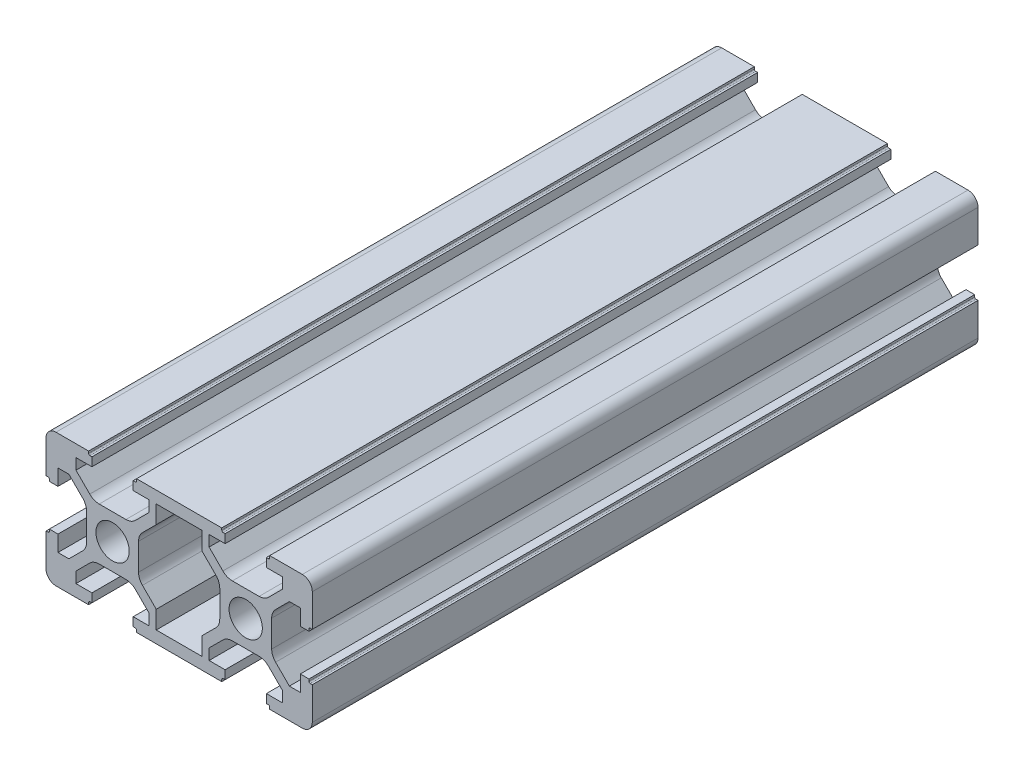
from build123d import *

# Parameters (mm, degrees)
SKETCH2_W               = 40
SKETCH2_H               = 20
BOSS_EXTRUDE1_DEPTH     = 100
CUT_EXTRUDE1_DEPTH      = 103.46950766
CUT_EXTRUDE1_DEPTH_BACK = 103.46950766
SKETCH3_R               = 2.5
FILLET1_R               = 1.5


with BuildPart() as part:
    # Sketch2 → Boss-Extrude1 (new body)
    with BuildSketch(Plane.XY):
        Rectangle(SKETCH2_W, SKETCH2_H)
    extrude(amount=-BOSS_EXTRUDE1_DEPTH)

    # Sketch3 → Cut-Extrude1 (cut, two sides: drawn at the far end of the back side and taken through both)
    with BuildSketch(Plane.XY.offset(-CUT_EXTRUDE1_DEPTH_BACK)):
        with Locations((-10, 0)):
            Circle(SKETCH3_R)
        with Locations(Location((10, 0, 0), (0, 0, 180))):
            Circle(SKETCH3_R)
        with BuildLine():
            Line((-13.6, 10), (-6.4, 10))
            Line((-6.4, 10), (-6.4, 9.7))
            ThreePointArc((-6.4, 9.7), (-6.458578644, 9.558578644), (-6.6, 9.5))
            Line((-6.6, 9.5), (-6.9, 9.5))
            Line((-6.9, 9.5), (-6.9, 8.2))
            Line((-6.9, 8.2), (-4.5, 8.2))
            Line((-4.5, 8.2), (-4.5, 6.560660172))
            Line((-4.5, 6.560660172), (-6.574873734, 4.485786438))
            ThreePointArc((-6.574873734, 4.485786438), (-7.223720432, 4.052240935), (-7.989087297, 3.9))
            Line((-7.989087297, 3.9), (-12.010912703, 3.9))
            ThreePointArc((-12.010912703, 3.9), (-12.776279568, 4.052240935), (-13.425126266, 4.485786438))
            Line((-13.425126266, 4.485786438), (-15.5, 6.560660172))
            Line((-15.5, 6.560660172), (-15.5, 8.2))
            Line((-15.5, 8.2), (-13.1, 8.2))
            Line((-13.1, 8.2), (-13.1, 9.5))
            Line((-13.1, 9.5), (-13.4, 9.5))
            ThreePointArc((-13.4, 9.5), (-13.541421356, 9.558578644), (-13.6, 9.7))
            Line((-13.6, 9.7), (-13.6, 10))
        make_face()
        with BuildLine():
            Line((-13.6, -10), (-13.6, -9.7))
            ThreePointArc((-13.6, -9.7), (-13.541421356, -9.558578644), (-13.4, -9.5))
            Line((-13.4, -9.5), (-13.1, -9.5))
            Line((-13.1, -9.5), (-13.1, -8.2))
            Line((-13.1, -8.2), (-15.5, -8.2))
            Line((-15.5, -8.2), (-15.5, -6.560660172))
            Line((-15.5, -6.560660172), (-13.425126266, -4.485786438))
            ThreePointArc((-13.425126266, -4.485786438), (-12.776279568, -4.052240935), (-12.010912703, -3.9))
            Line((-12.010912703, -3.9), (-7.989087297, -3.9))
            ThreePointArc((-7.989087297, -3.9), (-7.223720432, -4.052240935), (-6.574873734, -4.485786438))
            Line((-6.574873734, -4.485786438), (-4.5, -6.560660172))
            Line((-4.5, -6.560660172), (-4.5, -8.2))
            Line((-4.5, -8.2), (-6.9, -8.2))
            Line((-6.9, -8.2), (-6.9, -9.5))
            Line((-6.9, -9.5), (-6.6, -9.5))
            ThreePointArc((-6.6, -9.5), (-6.458578644, -9.558578644), (-6.4, -9.7))
            Line((-6.4, -9.7), (-6.4, -10))
            Line((-6.4, -10), (-13.6, -10))
        make_face()
        with BuildLine():
            Line((13.6, -10), (6.4, -10))
            Line((6.4, -10), (6.4, -9.7))
            ThreePointArc((6.4, -9.7), (6.458578644, -9.558578644), (6.6, -9.5))
            Line((6.6, -9.5), (6.9, -9.5))
            Line((6.9, -9.5), (6.9, -8.2))
            Line((6.9, -8.2), (4.5, -8.2))
            Line((4.5, -8.2), (4.5, -6.560660172))
            Line((4.5, -6.560660172), (6.574873734, -4.485786438))
            ThreePointArc((6.574873734, -4.485786438), (7.223720432, -4.052240935), (7.989087297, -3.9))
            Line((7.989087297, -3.9), (12.010912703, -3.9))
            ThreePointArc((12.010912703, -3.9), (12.776279568, -4.052240935), (13.425126266, -4.485786438))
            Line((13.425126266, -4.485786438), (15.5, -6.560660172))
            Line((15.5, -6.560660172), (15.5, -8.2))
            Line((15.5, -8.2), (13.1, -8.2))
            Line((13.1, -8.2), (13.1, -9.5))
            Line((13.1, -9.5), (13.4, -9.5))
            ThreePointArc((13.4, -9.5), (13.541421356, -9.558578644), (13.6, -9.7))
            Line((13.6, -9.7), (13.6, -10))
        make_face()
        with BuildLine():
            Line((13.6, 10), (13.6, 9.7))
            ThreePointArc((13.6, 9.7), (13.541421356, 9.558578644), (13.4, 9.5))
            Line((13.4, 9.5), (13.1, 9.5))
            Line((13.1, 9.5), (13.1, 8.2))
            Line((13.1, 8.2), (15.5, 8.2))
            Line((15.5, 8.2), (15.5, 6.560660172))
            Line((15.5, 6.560660172), (13.425126266, 4.485786438))
            ThreePointArc((13.425126266, 4.485786438), (12.776279568, 4.052240935), (12.010912703, 3.9))
            Line((12.010912703, 3.9), (7.989087297, 3.9))
            ThreePointArc((7.989087297, 3.9), (7.223720432, 4.052240935), (6.574873734, 4.485786438))
            Line((6.574873734, 4.485786438), (4.5, 6.560660172))
            Line((4.5, 6.560660172), (4.5, 8.2))
            Line((4.5, 8.2), (6.9, 8.2))
            Line((6.9, 8.2), (6.9, 9.5))
            Line((6.9, 9.5), (6.6, 9.5))
            ThreePointArc((6.6, 9.5), (6.458578644, 9.558578644), (6.4, 9.7))
            Line((6.4, 9.7), (6.4, 10))
            Line((6.4, 10), (13.6, 10))
        make_face()
        with BuildLine():
            Line((-16.560660172, -5.5), (-18.2, -5.5))
            Line((-18.2, -5.5), (-18.2, -3.1))
            Line((-18.2, -3.1), (-19.5, -3.1))
            Line((-19.5, -3.1), (-19.5, -3.4))
            ThreePointArc((-19.5, -3.4), (-19.558578644, -3.541421356), (-19.7, -3.6))
            Line((-19.7, -3.6), (-20, -3.6))
            Line((-20, -3.6), (-20, 3.6))
            Line((-20, 3.6), (-19.7, 3.6))
            ThreePointArc((-19.7, 3.6), (-19.558578644, 3.541421356), (-19.5, 3.4))
            Line((-19.5, 3.4), (-19.5, 3.1))
            Line((-19.5, 3.1), (-18.2, 3.1))
            Line((-18.2, 3.1), (-18.2, 5.5))
            Line((-18.2, 5.5), (-16.560660172, 5.5))
            Line((-16.560660172, 5.5), (-14.485786438, 3.425126266))
            ThreePointArc((-14.485786438, 3.425126266), (-14.052240935, 2.776279568), (-13.9, 2.010912703))
            Line((-13.9, 2.010912703), (-13.9, -2.010912703))
            ThreePointArc((-13.9, -2.010912703), (-14.052240935, -2.776279568), (-14.485786438, -3.425126266))
            Line((-14.485786438, -3.425126266), (-16.560660172, -5.5))
        make_face()
        with BuildLine():
            Line((14.485786438, -3.425126266), (16.560660172, -5.5))
            Line((16.560660172, -5.5), (18.2, -5.5))
            Line((18.2, -5.5), (18.2, -3.1))
            Line((18.2, -3.1), (19.5, -3.1))
            Line((19.5, -3.1), (19.5, -3.4))
            ThreePointArc((19.5, -3.4), (19.558578644, -3.541421356), (19.7, -3.6))
            Line((19.7, -3.6), (20, -3.6))
            Line((20, -3.6), (20, 3.6))
            Line((20, 3.6), (19.7, 3.6))
            ThreePointArc((19.7, 3.6), (19.558578644, 3.541421356), (19.5, 3.4))
            Line((19.5, 3.4), (19.5, 3.1))
            Line((19.5, 3.1), (18.2, 3.1))
            Line((18.2, 3.1), (18.2, 5.5))
            Line((18.2, 5.5), (16.560660172, 5.5))
            Line((16.560660172, 5.5), (14.485786438, 3.425126266))
            ThreePointArc((14.485786438, 3.425126266), (14.052240935, 2.776279568), (13.9, 2.010912703))
            Line((13.9, 2.010912703), (13.9, -2.010912703))
            ThreePointArc((13.9, -2.010912703), (14.052240935, -2.776279568), (14.485786438, -3.425126266))
        make_face()
        with BuildLine():
            Line((-3.439339828, 8.2), (-3.439339828, 5.5))
            Line((-3.439339828, 5.5), (-5.514213562, 3.425126266))
            ThreePointArc((-5.514213562, 3.425126266), (-5.947759065, 2.776279568), (-6.1, 2.010912703))
            Line((-6.1, 2.010912703), (-6.1, -2.010912703))
            ThreePointArc((-6.1, -2.010912703), (-5.947759065, -2.776279568), (-5.514213562, -3.425126266))
            Line((-5.514213562, -3.425126266), (-3.439339828, -5.5))
            Line((-3.439339828, -5.5), (-3.439339828, -8.2))
            Line((-3.439339828, -8.2), (3.439339828, -8.2))
            Line((3.439339828, -8.2), (3.439339828, -5.5))
            Line((3.439339828, -5.5), (5.514213562, -3.425126266))
            ThreePointArc((5.514213562, -3.425126266), (5.947759065, -2.776279568), (6.1, -2.010912703))
            Line((6.1, -2.010912703), (6.1, 2.010912703))
            ThreePointArc((6.1, 2.010912703), (5.947759065, 2.776279568), (5.514213562, 3.425126266))
            Line((5.514213562, 3.425126266), (3.439339828, 5.5))
            Line((3.439339828, 5.5), (3.439339828, 8.2))
            Line((3.439339828, 8.2), (-3.439339828, 8.2))
        make_face()
    extrude(amount=CUT_EXTRUDE1_DEPTH + CUT_EXTRUDE1_DEPTH_BACK, mode=Mode.SUBTRACT)

    # Fillet1
    fillet1_edges = [part.edges().sort_by_distance(p)[0] for p in [
        (20, -10, -50),
        (-20, -10, -50),
        (-20, 10, -50),
        (20, 10, -50),
    ]]
    fillet(fillet1_edges, radius=FILLET1_R)


solid = part.part
